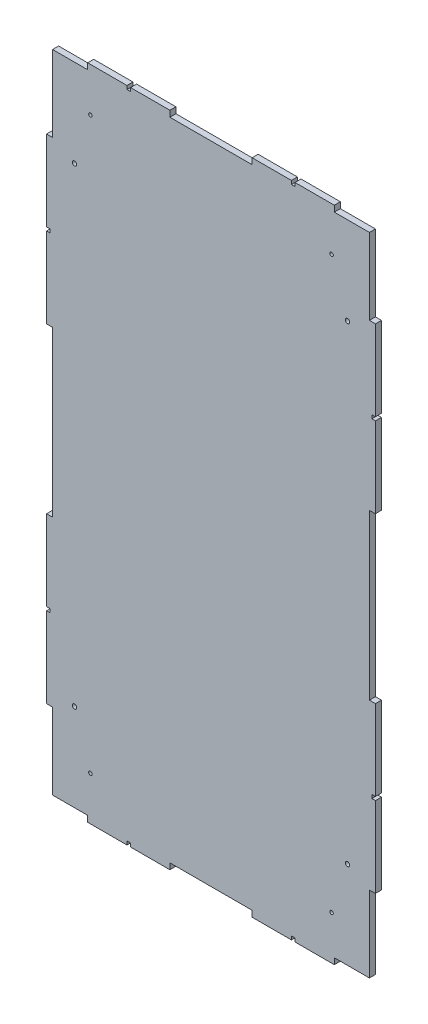
from build123d import *

# Parameters (mm, degrees)
BOSS_EXTRUDE1_DEPTH     = 5.5
CUT_EXTRUDE1_DEPTH      = 664.465030112
CUT_EXTRUDE1_DEPTH_BACK = 664.465030112
SKETCH3_R               = 1.6
CUT_EXTRUDE2_DEPTH      = 664.465030112


with BuildPart() as part:
    # Sketch1 → Boss-Extrude1 (new body)
    with BuildSketch(Plane.XY):
        Polygon((-0.002685186, 588.997205838), (-0.002685186, 519.497205838), (-5.502685186, 519.497205838), (-5.502685186, 446.122205838), (-2.252685186, 446.122205838), (-2.252685186, 444.497205838), (-2.252685186, 442.872205838), (-5.502685186, 442.872205838), (-5.502685186, 369.497205838), (-0.002685186, 369.497205838), (-0.002685186, 219.497205838), (-5.502685186, 219.497205838), (-5.502685186, 146.122205838), (-2.252685186, 146.122205838), (-2.252685186, 144.497205838), (-2.252685186, 142.872205838), (-5.502685186, 142.872205838), (-5.502685186, 69.497205838), (-0.002685186, 69.497205838), (-0.002685186, -0.002794162), (31.997314814, -0.002794162), (31.997314814, -5.502794162), (67.872314814, -5.502794162), (67.872314814, -2.252794162), (69.497314814, -2.252794162), (71.122314814, -2.252794162), (71.122314814, -5.502794162), (106.997314814, -5.502794162), (106.997314814, -0.002794162), (181.997314814, -0.002794162), (181.997314814, -5.502794162), (217.872314814, -5.502794162), (217.872314814, -2.252794162), (219.497314814, -2.252794162), (221.122314814, -2.252794162), (221.122314814, -5.502794162), (256.997314814, -5.502794162), (256.997314814, -0.002794162), (288.997314814, -0.002794162), (288.997314814, 69.497205838), (294.497314814, 69.497205838), (294.497314814, 142.872205838), (291.247314814, 142.872205838), (291.247314814, 144.497205838), (291.247314814, 146.122205838), (294.497314814, 146.122205838), (294.497314814, 219.497205838), (288.997314814, 219.497205838), (288.997314814, 369.497205838), (294.497314814, 369.497205838), (294.497314814, 442.872205838), (291.247314814, 442.872205838), (291.247314814, 444.497205838), (291.247314814, 446.122205838), (294.497314814, 446.122205838), (294.497314814, 519.497205838), (288.997314814, 519.497205838), (288.997314814, 588.997205838), (256.997314814, 588.997205838), (256.997314814, 594.497205838), (221.122314814, 594.497205838), (221.122314814, 591.247205838), (219.497314814, 591.247205838), (217.872314814, 591.247205838), (217.872314814, 594.497205838), (181.997314814, 594.497205838), (181.997314814, 588.997205838), (106.997314814, 588.997205838), (106.997314814, 594.497205838), (71.122314814, 594.497205838), (71.122314814, 591.247205838), (69.497314814, 591.247205838), (67.872314814, 591.247205838), (67.872314814, 594.497205838), (31.997314814, 594.497205838), (31.997314814, 588.997205838), align=None)
    extrude(amount=BOSS_EXTRUDE1_DEPTH)

    # Sketch2 → Cut-Extrude1 (cut, two sides: drawn at the far end of the back side and taken through both)
    with BuildSketch(Plane.XY.offset(-CUT_EXTRUDE1_DEPTH_BACK)):
        with BuildLine():
            ThreePointArc((270.997314814, 508.997205838), (268.997314814, 510.997205838), (266.997314814, 508.997205838))
            Line((266.997314814, 508.997205838), (268.997314814, 508.997205838))
            Line((268.997314814, 508.997205838), (268.997314814, 506.997205838))
            ThreePointArc((268.997314814, 506.997205838), (270.411528376, 507.582992276), (270.997314814, 508.997205838))
        make_face()
        with BuildLine():
            Line((268.997314814, 508.997205838), (266.997314814, 508.997205838))
            ThreePointArc((266.997314814, 508.997205838), (267.583101251, 507.582992276), (268.997314814, 506.997205838))
            Line((268.997314814, 506.997205838), (268.997314814, 508.997205838))
        make_face()
        with BuildLine():
            Line((19.997314814, 506.997205838), (19.997314814, 508.997205838))
            Line((19.997314814, 508.997205838), (21.997314814, 508.997205838))
            ThreePointArc((21.997314814, 508.997205838), (18.583101251, 510.4114194), (19.997314814, 506.997205838))
        make_face()
        with BuildLine():
            Line((21.997314814, 508.997205838), (19.997314814, 508.997205838))
            Line((19.997314814, 508.997205838), (19.997314814, 506.997205838))
            ThreePointArc((19.997314814, 506.997205838), (21.411528376, 507.582992276), (21.997314814, 508.997205838))
        make_face()
        with BuildLine():
            ThreePointArc((21.997314814, 79.997205838), (21.411528376, 81.4114194), (19.997314814, 81.997205838))
            Line((19.997314814, 81.997205838), (19.997314814, 79.997205838))
            Line((19.997314814, 79.997205838), (21.997314814, 79.997205838))
        make_face()
        with BuildLine():
            Line((19.997314814, 79.997205838), (19.997314814, 81.997205838))
            ThreePointArc((19.997314814, 81.997205838), (18.583101251, 78.582992276), (21.997314814, 79.997205838))
            Line((21.997314814, 79.997205838), (19.997314814, 79.997205838))
        make_face()
        with BuildLine():
            ThreePointArc((270.997314814, 79.997205838), (270.411528376, 81.4114194), (268.997314814, 81.997205838))
            Line((268.997314814, 81.997205838), (268.997314814, 79.997205838))
            Line((268.997314814, 79.997205838), (266.997314814, 79.997205838))
            ThreePointArc((266.997314814, 79.997205838), (268.997314814, 77.997205838), (270.997314814, 79.997205838))
        make_face()
        with BuildLine():
            Line((268.997314814, 79.997205838), (268.997314814, 81.997205838))
            ThreePointArc((268.997314814, 81.997205838), (267.583101251, 81.4114194), (266.997314814, 79.997205838))
            Line((266.997314814, 79.997205838), (268.997314814, 79.997205838))
        make_face()
    extrude(amount=CUT_EXTRUDE1_DEPTH + CUT_EXTRUDE1_DEPTH_BACK, mode=Mode.SUBTRACT)

    # Sketch3 → Cut-Extrude2 (cut, through all)
    with BuildSketch(Plane.XY.offset(5.5)):
        with Locations((34.497314814, 554.497205838)):
            Circle(SKETCH3_R)
        with Locations((254.497314814, 554.497205838)):
            Circle(SKETCH3_R)
        with Locations((34.497314814, 34.497205838)):
            Circle(SKETCH3_R)
        with Locations((254.497314814, 34.497205838)):
            Circle(SKETCH3_R)
    extrude(amount=-CUT_EXTRUDE2_DEPTH, mode=Mode.SUBTRACT)


solid = part.part
